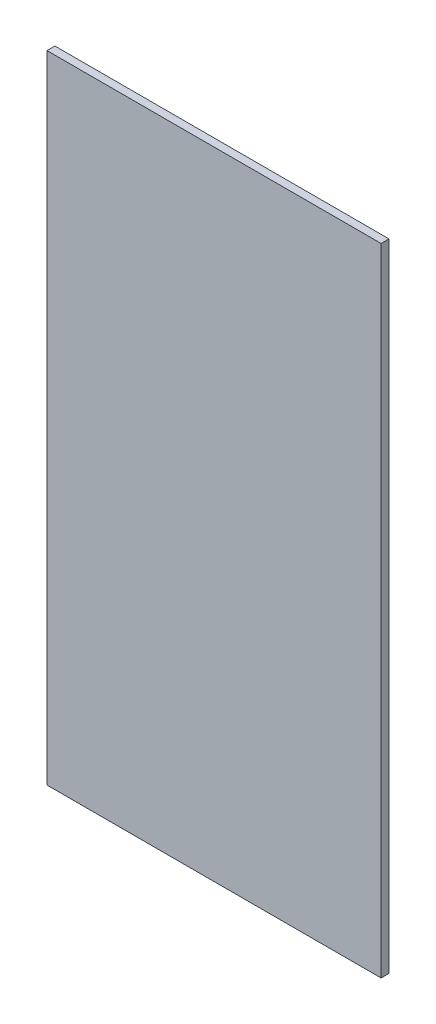
from build123d import *

# Parameters (mm, degrees)
SKETCH1_W           = 126.746
SKETCH1_H           = 241.3
BOSS_EXTRUDE1_DEPTH = 2.9972


with BuildPart() as part:
    # Sketch1 → Boss-Extrude1 (new body)
    with BuildSketch(Plane.XY):
        Rectangle(SKETCH1_W, SKETCH1_H)
    extrude(amount=BOSS_EXTRUDE1_DEPTH)


solid = part.part
